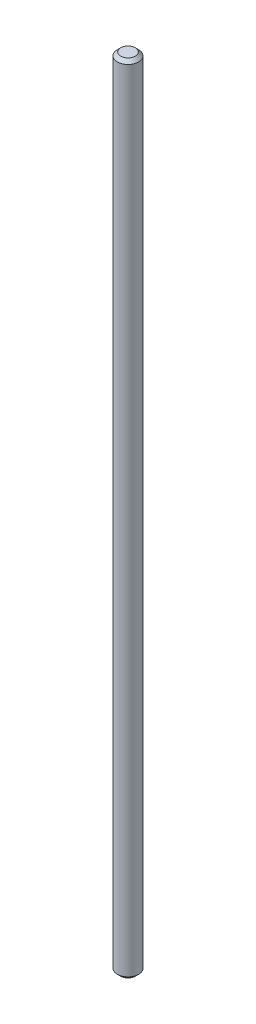
from build123d import *

# Parameters (mm, degrees)
SKETCH1_R           = 4
BOSS_EXTRUDE1_DEPTH = 300
CHAMFER1_SIZE       = 1.25


with BuildPart() as part:
    # Sketch1 → Boss-Extrude1 (new body)
    with BuildSketch(Plane(origin=(0, 0, 0), x_dir=(1, 0, 0), z_dir=(0, 1, 0))):
        with Locations(Location((0, 0, 0), (0, 0, 270))):
            Circle(SKETCH1_R)
    extrude(amount=BOSS_EXTRUDE1_DEPTH)

    # Chamfer1
    chamfer1_edges = [part.edges().sort_by_distance(p)[0] for p in [
        (0, 0, -4),
        (0, 300, -4),
    ]]
    chamfer(chamfer1_edges, length=CHAMFER1_SIZE)


solid = part.part
